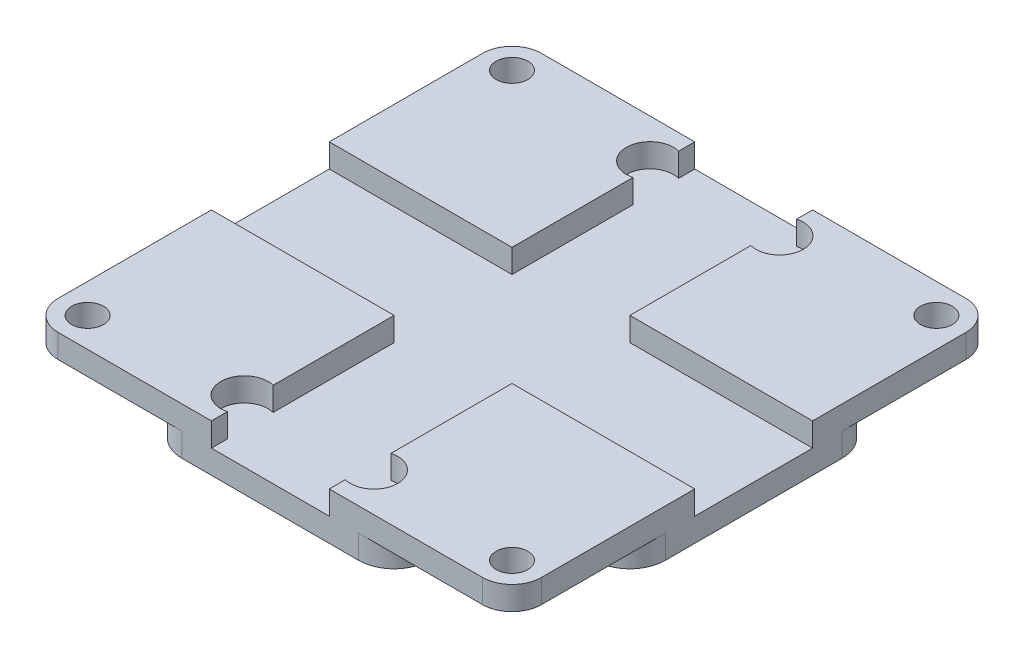
from build123d import *

# Parameters (mm, degrees)
EXTRUDE_1_DEPTH     = 4
SKETCH_2_R          = 1.35
CUT_EXTRUDE_1_DEPTH = 4
CUT_EXTRUDE_2_DEPTH = 2
SKETCH_4_W          = 46
SKETCH_4_H          = 10
CUT_EXTRUDE_3_DEPTH = 2
SKETCH_6_W          = 10
SKETCH_6_H          = 25
CUT_EXTRUDE_4_DEPTH = 2
SKETCH_7_R          = 2
CUT_EXTRUDE_5_DEPTH = 2


with BuildPart() as part:
    # 草图1 → 凸台-拉伸1 (new body)
    with BuildSketch(Plane(origin=(0, 0, 0), x_dir=(1, 0, 0), z_dir=(0, 1, 0))):
        with BuildLine():
            Line((2.5, 0), (38.5, 0))
            ThreePointArc((38.5, 0), (40.267766953, 0.732233047), (41, 2.5))
            Line((41, 2.5), (41, 38.5))
            ThreePointArc((41, 38.5), (40.267766953, 40.267766953), (38.5, 41))
            Line((38.5, 41), (2.5, 41))
            ThreePointArc((2.5, 41), (0.732233047, 40.267766953), (0, 38.5))
            Line((0, 38.5), (0, 2.5))
            ThreePointArc((0, 2.5), (0.732233047, 0.732233047), (2.5, 0))
        make_face()
    extrude(amount=-EXTRUDE_1_DEPTH)

    # 草图2 → 切除-拉伸1 (cut)
    with BuildSketch(Plane.XZ.offset(4)):
        with Locations(Location((2.5, -2.5, 0), (0, 0, 270))):
            Circle(SKETCH_2_R)
        with Locations(Location((38.5, -2.5, 0), (0, 0, 90))):
            Circle(SKETCH_2_R)
        with Locations(Location((2.5, -38.5, 0), (0, 0, 90))):
            Circle(SKETCH_2_R)
        with Locations(Location((38.5, -38.5, 0), (0, 0, 270))):
            Circle(SKETCH_2_R)
    extrude(amount=-CUT_EXTRUDE_1_DEPTH, mode=Mode.SUBTRACT)

    # 草图3 → 切除-拉伸2 (cut)
    with BuildSketch(Plane.XZ.offset(4)):
        with BuildLine():
            Line((0, -10), (0, -13))
            ThreePointArc((0, -13), (0.878679656, -10.878679656), (3, -10))
            Line((3, -10), (7, -10))
            ThreePointArc((7, -10), (9.121320344, -9.121320344), (10, -7))
            Line((10, -7), (10, -3))
            ThreePointArc((10, -3), (10.878679656, -0.878679656), (13, 0))
            Line((13, 0), (10, 0))
            Line((10, 0), (0, 0))
            Line((0, 0), (0, -10))
        make_face()
        with BuildLine():
            Line((41, 0), (41, -10))
            Line((41, -10), (41, -13))
            ThreePointArc((41, -13), (40.121320344, -10.878679656), (38, -10))
            Line((38, -10), (34, -10))
            ThreePointArc((34, -10), (31.878679656, -9.121320344), (31, -7))
            Line((31, -7), (31, -3))
            ThreePointArc((31, -3), (30.121320344, -0.878679656), (28, 0))
            Line((28, 0), (31, 0))
            Line((31, 0), (41, 0))
        make_face()
        with BuildLine():
            Line((41, -41), (31, -41))
            Line((31, -41), (28, -41))
            ThreePointArc((28, -41), (30.121320344, -40.121320344), (31, -38))
            Line((31, -38), (31, -34))
            ThreePointArc((31, -34), (31.878679656, -31.878679656), (34, -31))
            Line((34, -31), (38, -31))
            ThreePointArc((38, -31), (40.121320344, -30.121320344), (41, -28))
            Line((41, -28), (41, -31))
            Line((41, -31), (41, -41))
        make_face()
        with BuildLine():
            Line((0, -41), (0, -31))
            Line((0, -31), (0, -28))
            ThreePointArc((0, -28), (0.878679656, -30.121320344), (3, -31))
            Line((3, -31), (7, -31))
            ThreePointArc((7, -31), (9.121320344, -31.878679656), (10, -34))
            Line((10, -34), (10, -38))
            ThreePointArc((10, -38), (10.878679656, -40.121320344), (13, -41))
            Line((13, -41), (10, -41))
            Line((10, -41), (0, -41))
        make_face()
    extrude(amount=-CUT_EXTRUDE_2_DEPTH, mode=Mode.SUBTRACT)

    # 草图4 → 切除-拉伸3 (cut)
    with BuildSketch(Plane(origin=(0, 0, 0), x_dir=(1, 0, 0), z_dir=(0, 1, 0))):
        with Locations((20.5, 20.5)):
            Rectangle(SKETCH_4_W, SKETCH_4_H)
    extrude(amount=-CUT_EXTRUDE_3_DEPTH, mode=Mode.SUBTRACT)

    # 草图6 → 切除-拉伸4 (cut)
    with BuildSketch(Plane(origin=(0, 0, 0), x_dir=(1, 0, 0), z_dir=(0, 1, 0))):
        with Locations((20.5, 38)):
            Rectangle(SKETCH_6_W, SKETCH_6_H)
        with Locations((20.5, 3)):
            Rectangle(SKETCH_6_W, SKETCH_6_H)
    extrude(amount=-CUT_EXTRUDE_4_DEPTH, mode=Mode.SUBTRACT)

    # 草图7 → 切除-拉伸5 (cut)
    with BuildSketch(Plane(origin=(0, 0, 0), x_dir=(1, 0, 0), z_dir=(0, 1, 0))):
        with Locations((15, 37.7)):
            Circle(SKETCH_7_R)
        with Locations((26, 3.3)):
            Circle(SKETCH_7_R)
        with Locations((26, 37.7)):
            Circle(SKETCH_7_R)
        with Locations((15, 3.3)):
            Circle(SKETCH_7_R)
    extrude(amount=-CUT_EXTRUDE_5_DEPTH, mode=Mode.SUBTRACT)


solid = part.part
